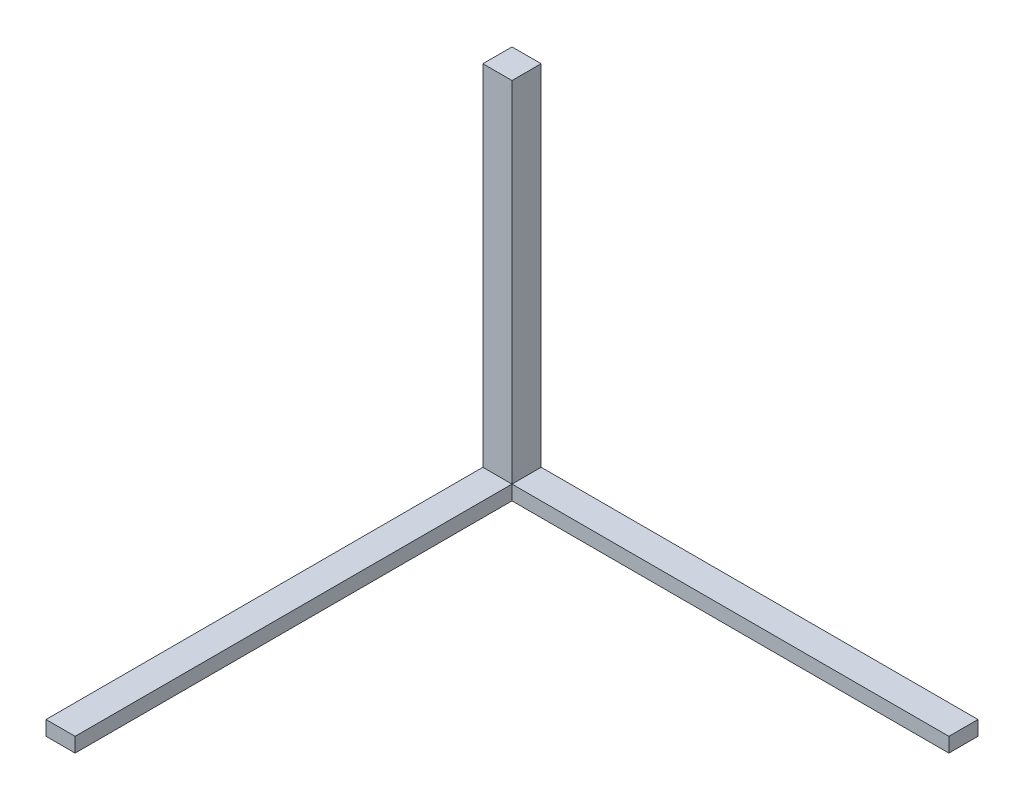
from build123d import *

# Parameters (mm, degrees)
SKETCH1_W           = 20
SKETCH1_H           = 20
BOSS_EXTRUDE1_DEPTH = 250
SKETCH2_W           = 20
SKETCH2_H           = 300
SKETCH2_W_2         = 300
SKETCH2_H_2         = 20
BOSS_EXTRUDE2_DEPTH = 10


with BuildPart() as part:
    # Sketch1 → Boss-Extrude1 (new body)
    with BuildSketch(Plane(origin=(0, 0, 0), x_dir=(1, 0, 0), z_dir=(0, 1, 0))):
        Rectangle(SKETCH1_W, SKETCH1_H)
    extrude(amount=BOSS_EXTRUDE1_DEPTH)

    # Sketch2 → Boss-Extrude2 (add)
    with BuildSketch(Plane(origin=(0, 0, 0), x_dir=(1, 0, 0), z_dir=(0, 1, 0))):
        with Locations((0, -160)):
            Rectangle(SKETCH2_W, SKETCH2_H)
        with Locations((160, 0)):
            Rectangle(SKETCH2_W_2, SKETCH2_H_2)
    extrude(amount=BOSS_EXTRUDE2_DEPTH)


solid = part.part
